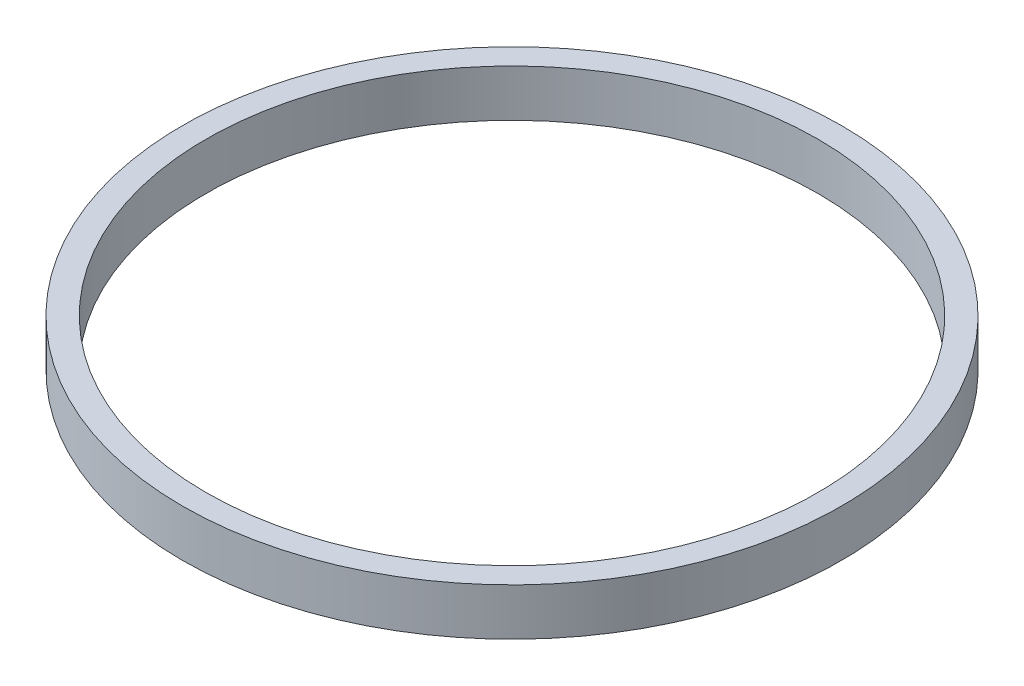
from build123d import *

# Parameters (mm, degrees)
IZIM1_R                     = 70
IZIM1_R_2                   = 65
Y_KSEKLIK_EKSTR_ZYON1_DEPTH = 10


with BuildPart() as part:
    # Çizim1 → Yükseklik-Ekstrüzyon1 (new body)
    with BuildSketch(Plane(origin=(0, 0, 0), x_dir=(1, 0, 0), z_dir=(0, 1, 0))):
        with Locations(Location((0, 0, 0), (0, 0, 270))):
            Circle(IZIM1_R)
        with Locations(Location((0, 0, 0), (0, 0, 270))):
            Circle(IZIM1_R_2, mode=Mode.SUBTRACT)
    extrude(amount=Y_KSEKLIK_EKSTR_ZYON1_DEPTH)


solid = part.part
